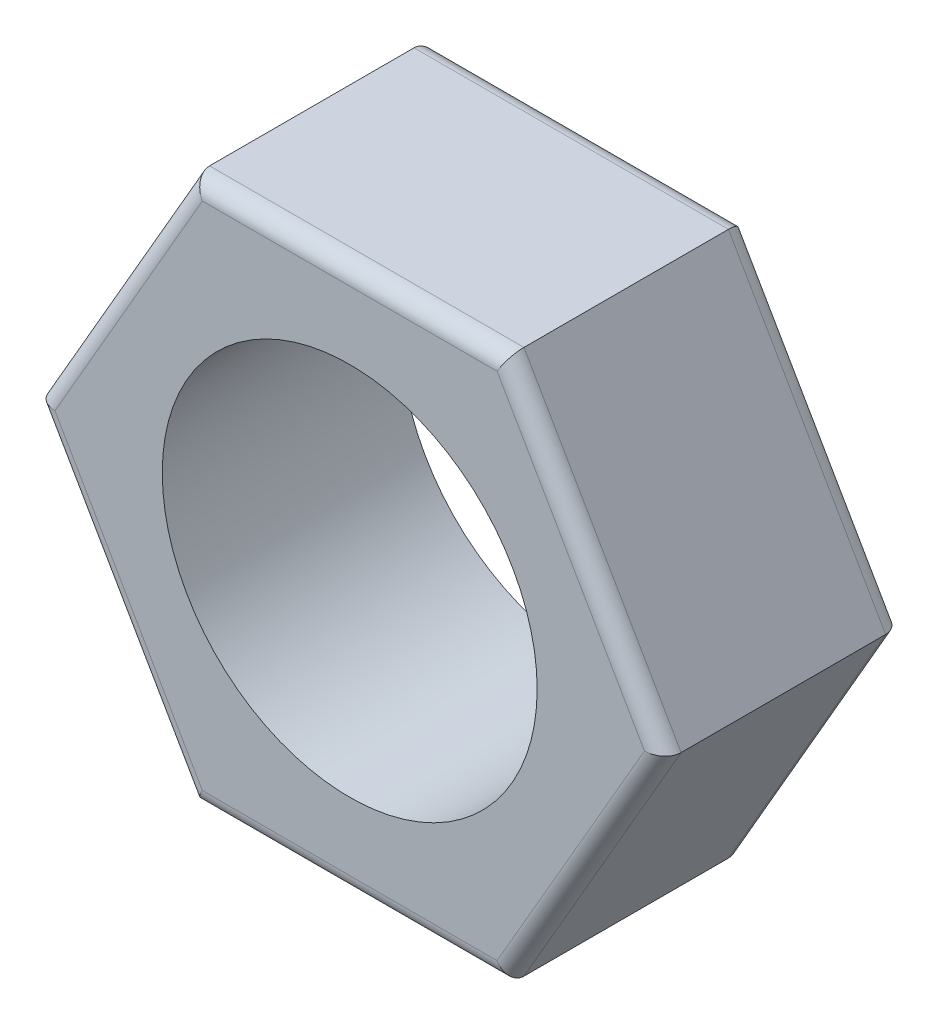
from build123d import *

# Parameters (mm, degrees)
EXTRUDE_1_DEPTH     = 14
SKETCH_3_R          = 11
CUT_EXTRUDE_2_DEPTH = 29.13724178
FILLET_1_R          = 1


with BuildPart() as part:
    # 草图2 → 拉伸1 (new body)
    with BuildSketch(Plane.XY):
        Polygon((9.225, -15.9781687), (18.45, 0), (9.225, 15.9781687), (-9.225, 15.9781687), (-18.45, 0), (-9.225, -15.9781687), align=None)
    extrude(amount=EXTRUDE_1_DEPTH)

    # 草图3 → 拉伸2 (cut, through all)
    with BuildSketch(Plane(origin=(0, 0, 0), x_dir=(-1, 0, 0), z_dir=(0, 0, -1))):
        Circle(SKETCH_3_R)
    extrude(amount=-CUT_EXTRUDE_2_DEPTH, mode=Mode.SUBTRACT)

    # 圆角1
    fillet_1_edges = [part.edges().sort_by_distance(p)[0] for p in [
        (13.8375, 7.98908435, 14),
        (0, 15.9781687, 14),
        (-13.8375, 7.98908435, 14),
        (-13.8375, -7.98908435, 14),
        (0, -15.9781687, 14),
        (-13.8375, -7.98908435, 0),
        (-13.8375, 7.98908435, 0),
        (0, 15.9781687, 0),
        (13.8375, -7.98908435, 14),
        (13.8375, 7.98908435, 0),
        (13.8375, -7.98908435, 0),
        (0, -15.9781687, 0),
    ]]
    fillet(fillet_1_edges, radius=FILLET_1_R)


solid = part.part
